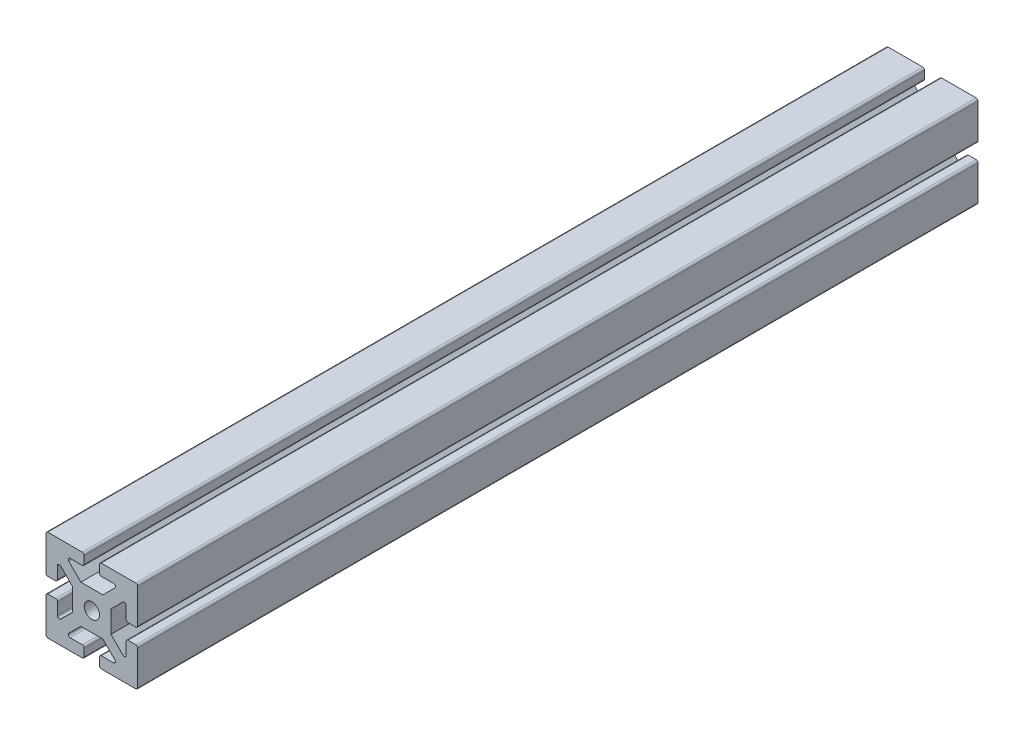
from build123d import *

# Parameters (mm, degrees)
SKETCH1_R           = 1
BOSS_EXTRUDE1_DEPTH = 110


with BuildPart() as part:
    # Sketch1 → Boss-Extrude1 (new body)
    with BuildSketch(Plane.XY):
        with BuildLine():
            Line((3.012563133, 4.073223305), (1.439339828, 2.5))
            Line((1.439339828, 2.5), (-1.439339828, 2.5))
            Line((-1.439339828, 2.5), (-3.012563133, 4.073223305))
            ThreePointArc((-3.012563133, 4.073223305), (-3.066756321, 4.345670858), (-2.835786438, 4.5))
            Line((-2.835786438, 4.5), (-1.25, 4.5))
            ThreePointArc((-1.25, 4.5), (-1.073223305, 4.573223305), (-1, 4.75))
            Line((-1, 4.75), (-1, 5.75))
            ThreePointArc((-1, 5.75), (-1.073223305, 5.926776695), (-1.25, 6))
            Line((-1.25, 6), (-5.75, 6))
            ThreePointArc((-5.75, 6), (-5.926776695, 5.926776695), (-6, 5.75))
            Line((-6, 5.75), (-6, 1.25))
            ThreePointArc((-6, 1.25), (-5.926776695, 1.073223305), (-5.75, 1))
            Line((-5.75, 1), (-4.75, 1))
            ThreePointArc((-4.75, 1), (-4.573223305, 1.073223305), (-4.5, 1.25))
            Line((-4.5, 1.25), (-4.5, 2.835786438))
            ThreePointArc((-4.5, 2.835786438), (-4.345670858, 3.066756321), (-4.073223305, 3.012563133))
            Line((-4.073223305, 3.012563133), (-2.5, 1.439339828))
            Line((-2.5, 1.439339828), (-2.5, -1.439339828))
            Line((-2.5, -1.439339828), (-4.073223305, -3.012563133))
            ThreePointArc((-4.073223305, -3.012563133), (-4.345670858, -3.066756321), (-4.5, -2.835786438))
            Line((-4.5, -2.835786438), (-4.5, -1.25))
            ThreePointArc((-4.5, -1.25), (-4.573223305, -1.073223305), (-4.75, -1))
            Line((-4.75, -1), (-5.75, -1))
            ThreePointArc((-5.75, -1), (-5.926776695, -1.073223305), (-6, -1.25))
            Line((-6, -1.25), (-6, -5.75))
            ThreePointArc((-6, -5.75), (-5.926776695, -5.926776695), (-5.75, -6))
            Line((-5.75, -6), (-1.25, -6))
            ThreePointArc((-1.25, -6), (-1.073223305, -5.926776695), (-1, -5.75))
            Line((-1, -5.75), (-1, -4.75))
            ThreePointArc((-1, -4.75), (-1.073223305, -4.573223305), (-1.25, -4.5))
            Line((-1.25, -4.5), (-2.835786438, -4.5))
            ThreePointArc((-2.835786438, -4.5), (-3.066756321, -4.345670858), (-3.012563133, -4.073223305))
            Line((-3.012563133, -4.073223305), (-1.439339828, -2.5))
            Line((-1.439339828, -2.5), (1.439339828, -2.5))
            Line((1.439339828, -2.5), (3.012563133, -4.073223305))
            ThreePointArc((3.012563133, -4.073223305), (3.066756321, -4.345670858), (2.835786438, -4.5))
            Line((2.835786438, -4.5), (1.25, -4.5))
            ThreePointArc((1.25, -4.5), (1.073223305, -4.573223305), (1, -4.75))
            Line((1, -4.75), (1, -5.75))
            ThreePointArc((1, -5.75), (1.073223305, -5.926776695), (1.25, -6))
            Line((1.25, -6), (5.75, -6))
            ThreePointArc((5.75, -6), (5.926776695, -5.926776695), (6, -5.75))
            Line((6, -5.75), (6, -1.25))
            ThreePointArc((6, -1.25), (5.926776695, -1.073223305), (5.75, -1))
            Line((5.75, -1), (4.75, -1))
            ThreePointArc((4.75, -1), (4.573223305, -1.073223305), (4.5, -1.25))
            Line((4.5, -1.25), (4.5, -2.835786438))
            ThreePointArc((4.5, -2.835786438), (4.345670858, -3.066756321), (4.073223305, -3.012563133))
            Line((4.073223305, -3.012563133), (2.5, -1.439339828))
            Line((2.5, -1.439339828), (2.5, 1.439339828))
            Line((2.5, 1.439339828), (4.073223305, 3.012563133))
            ThreePointArc((4.073223305, 3.012563133), (4.345670858, 3.066756321), (4.5, 2.835786438))
            Line((4.5, 2.835786438), (4.5, 1.25))
            ThreePointArc((4.5, 1.25), (4.573223305, 1.073223305), (4.75, 1))
            Line((4.75, 1), (5.75, 1))
            ThreePointArc((5.75, 1), (5.926776695, 1.073223305), (6, 1.25))
            Line((6, 1.25), (6, 5.75))
            ThreePointArc((6, 5.75), (5.926776695, 5.926776695), (5.75, 6))
            Line((5.75, 6), (1.25, 6))
            ThreePointArc((1.25, 6), (1.073223305, 5.926776695), (1, 5.75))
            Line((1, 5.75), (1, 4.75))
            ThreePointArc((1, 4.75), (1.073223305, 4.573223305), (1.25, 4.5))
            Line((1.25, 4.5), (2.835786438, 4.5))
            ThreePointArc((2.835786438, 4.5), (3.066756321, 4.345670858), (3.012563133, 4.073223305))
        make_face()
        Circle(SKETCH1_R, mode=Mode.SUBTRACT)
    extrude(amount=-BOSS_EXTRUDE1_DEPTH)


solid = part.part
